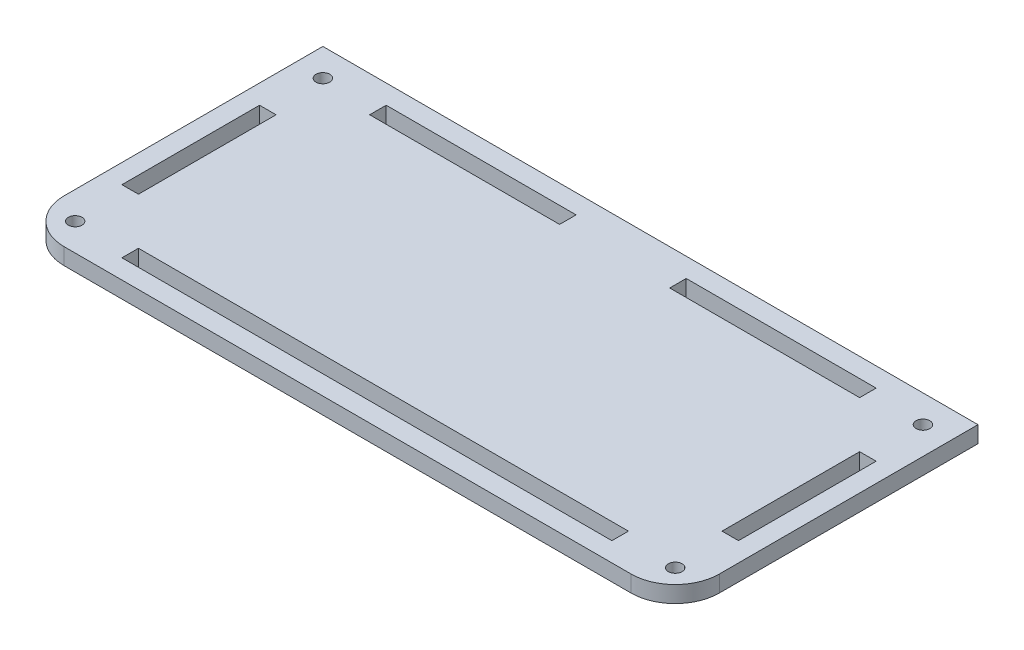
from build123d import *

# Parameters (mm, degrees)
SCHIZZO1_W                   = 119
SCHIZZO1_H                   = 55
ESTRUSIONE_ESTRUSIONE1_DEPTH = 3
FORO_FILETTATO_M3X0_5_1_D    = 2.5
SCHIZZO4_W                   = 89
SCHIZZO4_H                   = 3
SCHIZZO4_W_2                 = 3
SCHIZZO4_H_2                 = 25
TAGLIO_ESTRUSIONE1_DEPTH     = 66.616308948
RACCORDO1_R                  = 8
SCHIZZO5_W                   = 34.5
SCHIZZO5_H                   = 3
TAGLIO_ESTRUSIONE2_DEPTH     = 10


with BuildPart() as part:
    # Schizzo1 → Estrusione-Estrusione1 (new body)
    with BuildSketch(Plane(origin=(0, 0, 0), x_dir=(1, 0, 0), z_dir=(0, 1, 0))):
        Rectangle(SCHIZZO1_W, SCHIZZO1_H)
    extrude(amount=ESTRUSIONE_ESTRUSIONE1_DEPTH)

    # Foro filettato M3x0.5-1 (through all)
    with Locations(Plane(origin=(0, 3, 0), x_dir=(1, 0, 0), z_dir=(0, 1, 0))):
        with Locations((-54.5, -22.5), (54.5, -22.5), (54.5, 22.5), (-54.5, 22.5)):
            Hole(FORO_FILETTATO_M3X0_5_1_D / 2)

    # Schizzo4 → Taglio-Estrusione1 (cut, through all)
    with BuildSketch(Plane(origin=(0, 3, 0), x_dir=(1, 0, 0), z_dir=(0, 1, 0))):
        with Locations((0, -22.5)):
            Rectangle(SCHIZZO4_W, SCHIZZO4_H)
        with Locations((54.5, 0)):
            Rectangle(SCHIZZO4_W_2, SCHIZZO4_H_2)
        with Locations((-54.5, 0)):
            Rectangle(SCHIZZO4_W_2, SCHIZZO4_H_2)
    extrude(amount=-TAGLIO_ESTRUSIONE1_DEPTH, mode=Mode.SUBTRACT)

    # Raccordo1
    raccordo1_edges = [part.edges().sort_by_distance(p)[0] for p in [
        (59.5, 1.5, 27.5),
        (-59.5, 1.5, 27.5),
    ]]
    fillet(raccordo1_edges, radius=RACCORDO1_R)

    # Schizzo5 → Taglio-Estrusione2 (cut)
    with BuildSketch(Plane(origin=(0, 3, 0), x_dir=(1, 0, 0), z_dir=(0, 1, 0))):
        with Locations((27.25, 22.5)):
            Rectangle(SCHIZZO5_W, SCHIZZO5_H)
        with Locations((-27.25, 22.5)):
            Rectangle(SCHIZZO5_W, SCHIZZO5_H)
    extrude(amount=-TAGLIO_ESTRUSIONE2_DEPTH, mode=Mode.SUBTRACT)


solid = part.part
